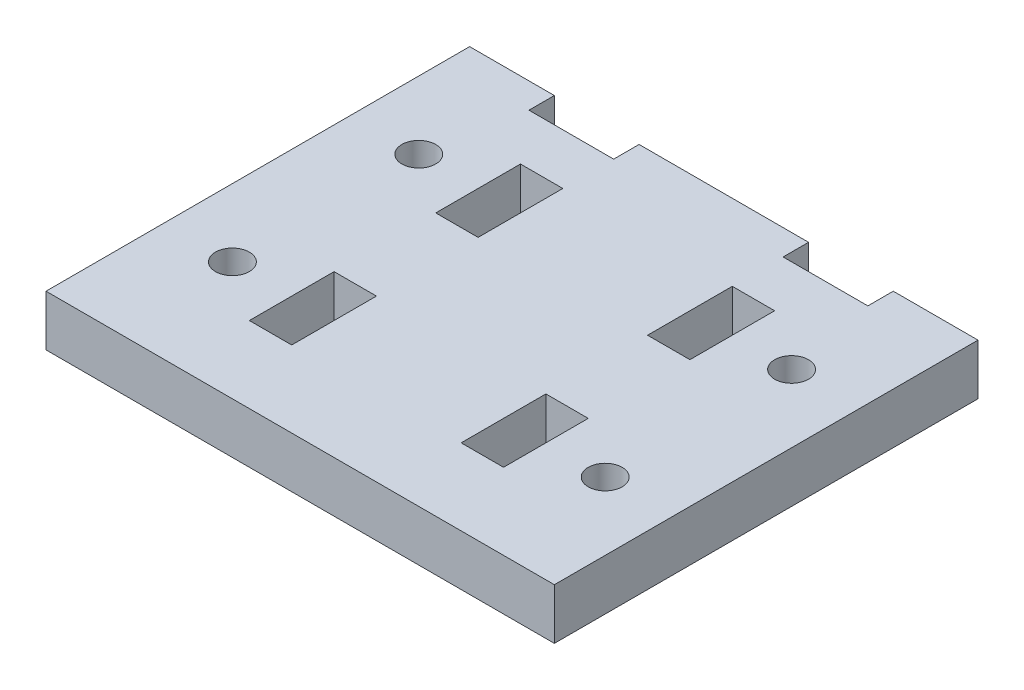
from build123d import *

# Parameters (mm, degrees)
SKETCH2_R           = 2
SKETCH2_W           = 5
SKETCH2_H           = 10
BOSS_EXTRUDE1_DEPTH = 6


with BuildPart() as part:
    # Sketch2 → Boss-Extrude1 (new body)
    with BuildSketch(Plane(origin=(0, 0, 0), x_dir=(1, 0, 0), z_dir=(0, 1, 0))):
        Polygon((-21.626106175, 30.870423783), (-11.626106175, 30.870423783), (-11.626106175, 27.870423783), (-1.626106175, 27.870423783), (-1.626106175, 30.870423783), (18.373893825, 30.870423783), (18.373893825, 27.870423783), (28.373893825, 27.870423783), (28.373893825, 30.870423783), (38.373893825, 30.870423783), (38.373893825, -19.129576217), (-21.626106175, -19.129576217), align=None)
        with Locations(Location((-13.626106175, 16.870423783, 0), (0, 0, 270))):
            Circle(SKETCH2_R, mode=Mode.SUBTRACT)
        with Locations(Location((-13.626106175, -5.129576217, 0), (0, 0, 270))):
            Circle(SKETCH2_R, mode=Mode.SUBTRACT)
        with Locations(Location((30.373893825, 16.870423783, 0), (0, 0, 270))):
            Circle(SKETCH2_R, mode=Mode.SUBTRACT)
        with Locations(Location((30.373893825, -5.129576217, 0), (0, 0, 270))):
            Circle(SKETCH2_R, mode=Mode.SUBTRACT)
        with Locations((20.873893825, 16.870423783)):
            Rectangle(SKETCH2_W, SKETCH2_H, mode=Mode.SUBTRACT)
        with Locations((-4.126106175, 16.870423783)):
            Rectangle(SKETCH2_W, SKETCH2_H, mode=Mode.SUBTRACT)
        with Locations((-4.126106175, -5.129576217)):
            Rectangle(SKETCH2_W, SKETCH2_H, mode=Mode.SUBTRACT)
        with Locations((20.873893825, -5.129576217)):
            Rectangle(SKETCH2_W, SKETCH2_H, mode=Mode.SUBTRACT)
    extrude(amount=BOSS_EXTRUDE1_DEPTH)


solid = part.part
